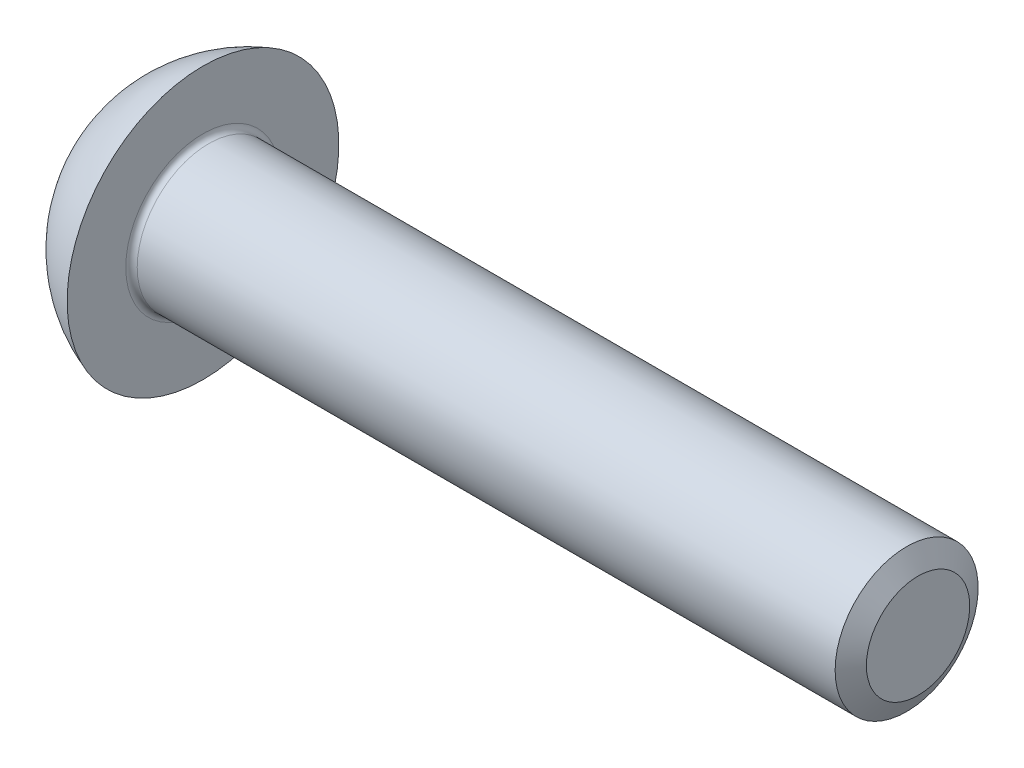
from build123d import *

# Parameters (mm, degrees)
CUT_EXTRUDE_1_DEPTH = 2.75


with BuildPart() as part:
    # 草图1 → 旋转1 (revolve)
    with BuildSketch(Plane.XY):
        with BuildLine():
            Line((0, 2.5), (-24.8, 2.5))
            ThreePointArc((-24.8, 2.5), (-24.941421356, 2.558578644), (-25, 2.7))
            Line((-25, 2.7), (-25, 4.75))
            ThreePointArc((-25, 4.75), (-26.581194586, 3.877015605), (-27.75, 2.5))
            Line((-27.75, 2.5), (-27.75, 0))
            Line((-27.75, 0), (0, 0))
            Line((0, 0), (0, 2.5))
        make_face()
    revolve(axis=Axis((-27.75, 0, 0), (1, 0, 0)))

    # 草图2 → 切除-拉伸1 (cut)
    with BuildSketch(Plane.ZY.offset(27.75)):
        Polygon((0, 1.732050808), (-1.5, 0.866025404), (-1.5, -0.866025404), (0, -1.732050808), (1.5, -0.866025404), (1.5, 0.866025404), align=None)
    extrude(amount=-CUT_EXTRUDE_1_DEPTH, mode=Mode.SUBTRACT)

    # 草图6 → 旋转2 (revolve)
    with BuildSketch(Plane.XY):
        Polygon((-26.19, 1.732050808), (-25, 0), (-24.56, 0), (-24.56, 1.732050808), align=None)
    revolve(axis=Axis((-27.75, 0, 0), (1, 0, 0)))

    # 草图7 → 切除-旋转5 (revolve, cut)
    with BuildSketch(Plane.XY):
        Polygon((-27.75, 1.732050808), (-27.31, 0), (-27.75, 0), align=None)
    revolve(axis=Axis((-27.75, 0, 0), (1, 0, 0)), mode=Mode.SUBTRACT)

    # 草图4 → 切除-旋转1 (revolve, cut)
    with BuildSketch(Plane.XY):
        Polygon((-0.4, 2.5), (0, 1.807179677), (0.4, 2.5), align=None)
    revolve(axis=Axis((-0.4, 0, 0), (1, 0, 0)), mode=Mode.SUBTRACT)


solid = part.part
